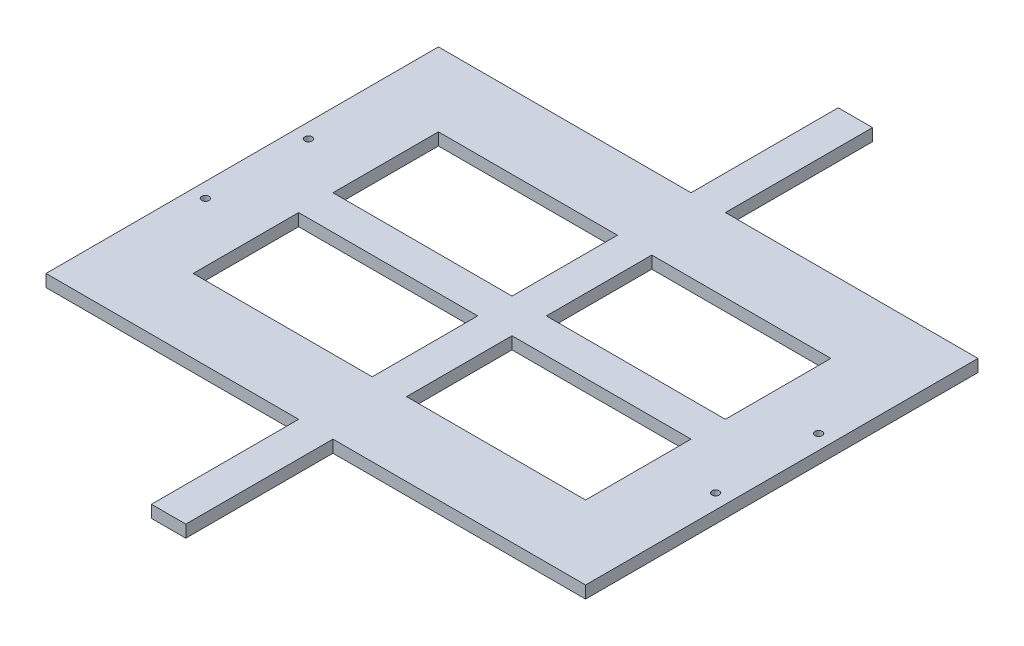
from build123d import *

# Parameters (mm, degrees)
SKETCH1_W           = 220
SKETCH1_H           = 160
SKETCH1_W_2         = 160
SKETCH1_H_2         = 100
SKETCH1_W_3         = 73
SKETCH1_H_3         = 14
SKETCH1_W_4         = 14
SKETCH1_H_4         = 43
BOSS_EXTRUDE1_DEPTH = 5
SKETCH2_R           = 1.5
CUT_EXTRUDE1_DEPTH  = 5
SKETCH3_W           = 14
SKETCH3_H           = 60
BOSS_EXTRUDE2_DEPTH = 5


with BuildPart() as part:
    # Sketch1 → Boss-Extrude1 (new body)
    # profile 1 of 6: a face of its own
    with BuildSketch(Plane(origin=(0, 0, 0), x_dir=(1, 0, 0), z_dir=(0, 1, 0))):
        with Locations((80, -50)):
            Rectangle(SKETCH1_W, SKETCH1_H)
        with Locations((80, -50)):
            Rectangle(SKETCH1_W_2, SKETCH1_H_2, mode=Mode.SUBTRACT)
    # profile 2 of 6: a face of its own
    with BuildSketch(Plane(origin=(0, 0, 0), x_dir=(1, 0, 0), z_dir=(0, 1, 0))):
        with Locations((36.5, -50)):
            Rectangle(SKETCH1_W_3, SKETCH1_H_3)
    # profile 3 of 6: a face of its own
    with BuildSketch(Plane(origin=(0, 0, 0), x_dir=(1, 0, 0), z_dir=(0, 1, 0))):
        with Locations((123.5, -50)):
            Rectangle(SKETCH1_W_3, SKETCH1_H_3)
    # profile 4 of 6: a face of its own
    with BuildSketch(Plane(origin=(0, 0, 0), x_dir=(1, 0, 0), z_dir=(0, 1, 0))):
        with Locations((80, -21.5)):
            Rectangle(SKETCH1_W_4, SKETCH1_H_4)
    # profile 5 of 6: a face of its own
    with BuildSketch(Plane(origin=(0, 0, 0), x_dir=(1, 0, 0), z_dir=(0, 1, 0))):
        with Locations((80, -78.5)):
            Rectangle(SKETCH1_W_4, SKETCH1_H_4)
    # profile 6 of 6: a face of its own
    with BuildSketch(Plane(origin=(0, 0, 0), x_dir=(1, 0, 0), z_dir=(0, 1, 0))):
        with Locations((80, -50)):
            Rectangle(SKETCH1_W_4, SKETCH1_H_3)
    extrude(amount=BOSS_EXTRUDE1_DEPTH)

    # Sketch2 → Cut-Extrude1 (cut)
    with BuildSketch(Plane(origin=(0, 5, 0), x_dir=(1, 0, 0), z_dir=(0, 1, 0))):
        with Locations(Location((-24, -29, 0), (0, 0, 270))):
            Circle(SKETCH2_R)
        with Locations(Location((-24, -71, 0), (0, 0, 90))):
            Circle(SKETCH2_R)
        with Locations(Location((184, -29, 0), (0, 0, 90))):
            Circle(SKETCH2_R)
        with Locations(Location((184, -71, 0), (0, 0, 270))):
            Circle(SKETCH2_R)
    extrude(amount=-CUT_EXTRUDE1_DEPTH, mode=Mode.SUBTRACT)

    # Sketch3 → Boss-Extrude2 (add)
    with BuildSketch(Plane(origin=(0, 5, 0), x_dir=(1, 0, 0), z_dir=(0, 1, 0))):
        with Locations((80, 60)):
            Rectangle(SKETCH3_W, SKETCH3_H)
        with Locations((80, -160)):
            Rectangle(SKETCH3_W, SKETCH3_H)
    extrude(amount=-BOSS_EXTRUDE2_DEPTH)


solid = part.part
